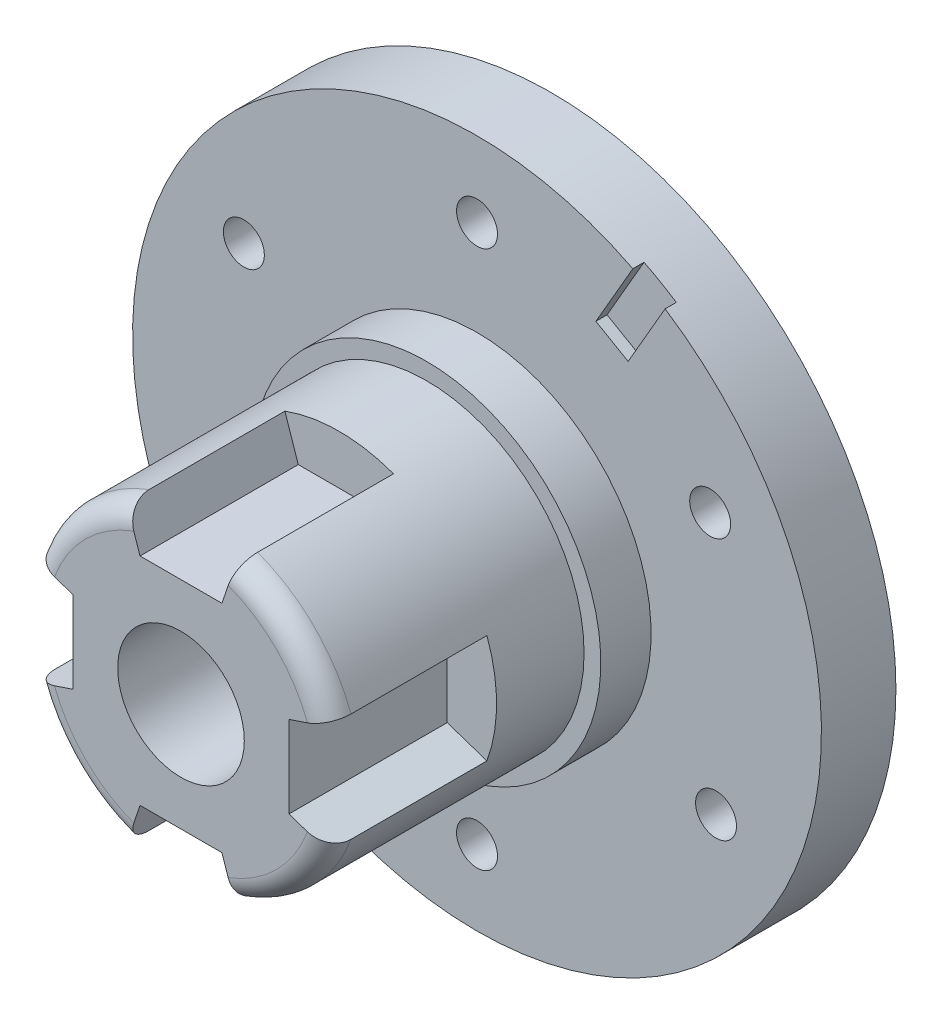
from build123d import *

# Parameters (mm, degrees)
SKETCH_1_R          = 18.5
SKETCH_1_R_2        = 1.1
EXTRUDE_1_DEPTH     = 4
SKETCH_3_R          = 8.45
EXTRUDE_3_DEPTH     = 15.9
FILLET_1_R          = 1.2
CUT_EXTRUDE_1_DEPTH = 8.5
SKETCH_5_R          = 9.35
EXTRUDE_4_DEPTH     = 2.7
SKETCH_6_R          = 1.1
CUT_EXTRUDE_2_DEPTH = 33.871111998
SKETCH_7_R          = 3.4
CUT_EXTRUDE_3_DEPTH = 6.5
CUT_EXTRUDE_START   = 4
CUT_EXTRUDE_5_DEPTH = 0.6


with BuildPart() as part:
    # Эскиз1 → Бобышка-Вытянуть1 (new body)
    with BuildSketch(Plane.XY):
        Circle(SKETCH_1_R)
        with Locations((0, 14.46)):
            Circle(SKETCH_1_R_2, mode=Mode.SUBTRACT)
        with Locations((-12.837810469, -6.654488888)):
            Circle(SKETCH_1_R_2, mode=Mode.SUBTRACT)
        with Locations((12.837810469, -6.654488888)):
            Circle(SKETCH_1_R_2, mode=Mode.SUBTRACT)
    extrude(amount=EXTRUDE_1_DEPTH)

    # Эскиз3 → Бобышка-Вытянуть3 (add)
    with BuildSketch(Plane.XY.offset(4)):
        Circle(SKETCH_3_R)
    extrude(amount=EXTRUDE_3_DEPTH)

    # Скругление1
    fillet_1_edges = [part.edges().sort_by_distance(p)[0] for p in [
        (-8.45, 0, 19.9),
    ]]
    fillet(fillet_1_edges, radius=FILLET_1_R)

    # Эскиз4 → Вырез-Вытянуть1 (cut)
    with BuildSketch(Plane.XY.offset(19.9)):
        with BuildLine():
            Line((-2.2, 5.799999981), (-2.931860794, 7.978357743))
            ThreePointArc((-2.931860794, 7.978357743), (-6.37e-07, 8.5), (2.931859599, 7.978358183))
            Line((2.931859599, 7.978358183), (2.2, 5.800000019))
            Line((2.2, 5.800000019), (-2.2, 5.799999981))
        make_face()
        with BuildLine():
            Line((5.799999981, 2.2), (7.978357743, 2.931860794))
            ThreePointArc((7.978357743, 2.931860794), (8.5, 6.37e-07), (7.978358183, -2.931859599))
            Line((7.978358183, -2.931859599), (5.800000019, -2.2))
            Line((5.800000019, -2.2), (5.799999981, 2.2))
        make_face()
        with BuildLine():
            Line((2.2, -5.799999981), (2.931860794, -7.978357743))
            ThreePointArc((2.931860794, -7.978357743), (6.37e-07, -8.5), (-2.931859599, -7.978358183))
            Line((-2.931859599, -7.978358183), (-2.2, -5.800000019))
            Line((-2.2, -5.800000019), (2.2, -5.799999981))
        make_face()
        with BuildLine():
            Line((-5.799999981, -2.2), (-7.978357743, -2.931860794))
            ThreePointArc((-7.978357743, -2.931860794), (-8.5, -6.37e-07), (-7.978358183, 2.931859599))
            Line((-7.978358183, 2.931859599), (-5.800000019, 2.2))
            Line((-5.800000019, 2.2), (-5.799999981, -2.2))
        make_face()
    extrude(amount=-CUT_EXTRUDE_1_DEPTH, mode=Mode.SUBTRACT)

    # Эскиз5 → Бобышка-Вытянуть4 (add)
    with BuildSketch(Plane.XY.offset(4)):
        with Locations(Location((0, 0, 0), (0, 0, 180))):
            Circle(SKETCH_5_R)
    extrude(amount=EXTRUDE_4_DEPTH)

    # Эскиз6 → Вырез-Вытянуть2 (cut, through all)
    with BuildSketch(Plane(origin=(0, 0, 0), x_dir=(-1, 0, 0), z_dir=(0, 0, -1))):
        with Locations((-12.522727339, 7.23)):
            Circle(SKETCH_6_R)
        with Locations((12.522727339, 7.23)):
            Circle(SKETCH_6_R)
        with Locations((0, -14.46)):
            Circle(SKETCH_6_R)
    extrude(amount=-CUT_EXTRUDE_2_DEPTH, mode=Mode.SUBTRACT)

    # Эскиз7 → Вырез-Вытянуть3 (cut)
    with BuildSketch(Plane.XY.offset(19.9)):
        Circle(SKETCH_7_R)
    extrude(amount=-CUT_EXTRUDE_3_DEPTH, mode=Mode.SUBTRACT)

    # Эскиз8 → Вырез-Вытянуть5 (cut)
    with BuildSketch(Plane.XY.offset(CUT_EXTRUDE_START)):
        Polygon((8.116025404, 12.057368355), (10.116025404, 15.52146997), (8.383974596, 16.52146997), (6.383974596, 13.057368355), align=None)
    extrude(amount=-CUT_EXTRUDE_5_DEPTH, mode=Mode.SUBTRACT)


solid = part.part
